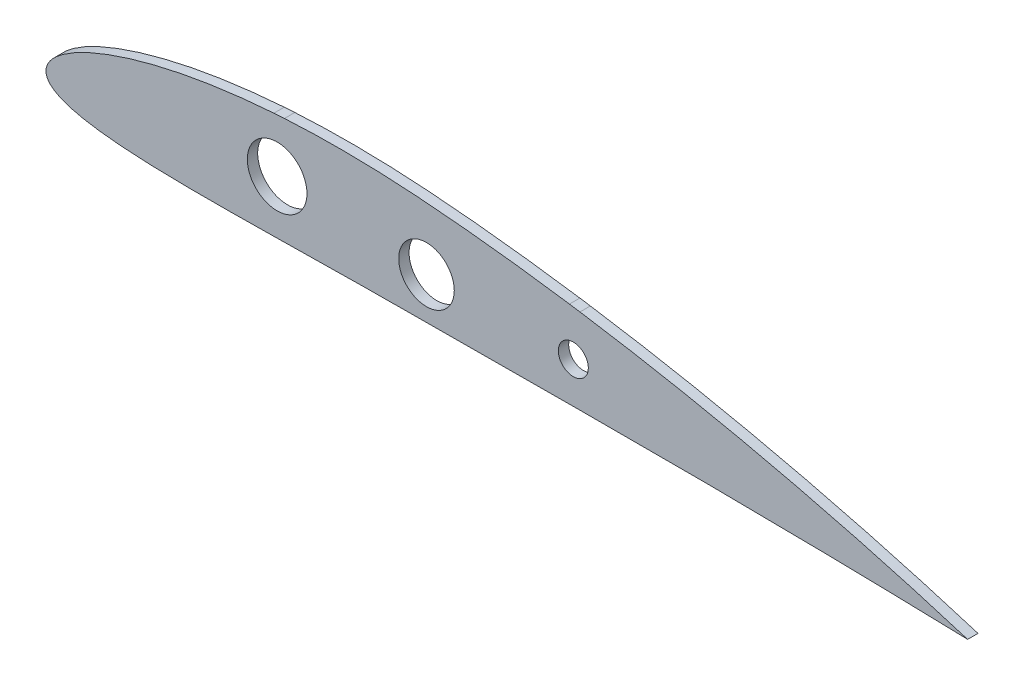
from build123d import *

# Parameters (mm, degrees)
SKETCH_1_R      = 4.05
SKETCH_1_R_2    = 7.5
SKETCH_1_R_3    = 8.05
EXTRUDE_1_DEPTH = 1.4


with BuildPart() as part:
    # Эскиз1 → Бобышка-Вытянуть1 (new, symmetric)
    with BuildSketch(Plane.XY):
        with BuildLine():
            Line((150.666396798, 129.82962039), (147.830444309, 130.255907631))
            add(Edge.make_bspline(
                [(147.830444309, 130.255907631), (141.461413304, 131.198524366), (128.693359955, 132.886388705), (112.67043132, 134.461645249), (99.826968741, 135.315000175), (86.964020356, 135.731264376), (77.308341909, 135.549477481), (70.887732655, 135.171040436)],
                knots=[0.429725304, 0.429725304, 0.429725304, 0.429725304, 0.50454493, 0.579364556, 0.61677437, 0.654184183, 0.729003809, 0.729003809, 0.729003809, 0.729003809], degree=3))
            Line((70.887732655, 135.171040436), (68.034324351, 134.985663537))
            add(Edge.make_bspline(
                [(68.034324351, 134.985663537), (62.466327292, 134.590052619), (54.128766773, 133.70015523), (43.125220573, 131.802909904), (34.953776148, 129.977054104), (26.907191476, 127.675989274), (20.367980904, 125.262128549), (15.336549935, 122.888373263), (11.739560791, 120.808049659), (8.991532459, 118.696410574), (7.481749343, 116.886227925), (6.915411804, 115.858161553), (6.707897041, 115.274334726), (6.625457542, 114.936901915), (6.585428501, 114.77290226)],
                knots=[0.740090669, 0.740090669, 0.740090669, 0.740090669, 0.805048089, 0.837526799, 0.870005509, 0.902484219, 0.934962929, 0.951202284, 0.967441639, 0.983680994, 0.991800672, 0.99586051, 0.99789043, 0.999920349, 0.999920349, 0.999920349, 0.999920349], degree=3))
            add(Edge.make_bspline(
                [(6.585428501, 114.77290226), (6.563664146, 114.614273348), (6.519009347, 114.285406452), (6.51479073, 113.71087901), (6.741898783, 112.661535219), (7.660184293, 111.409854013), (9.25908473, 110.308268876), (11.044608157, 109.487380203), (12.922194441, 108.850067694), (15.490126457, 108.172753601), (18.768502962, 107.558568007), (22.745443376, 107.043168294), (28.077313003, 106.557350362), (34.7695904, 106.213470375), (42.813490811, 106.037235573), (50.86267748, 106.006056339), (58.913615572, 106.062256394), (64.282042193, 106.132538161), (66.96601172, 106.171159397)],
                knots=[8.1168e-05, 8.1168e-05, 8.1168e-05, 8.1168e-05, 0.0020673, 0.004053433, 0.008025699, 0.015970231, 0.023914763, 0.031859294, 0.039803826, 0.047748358, 0.063637421, 0.079526485, 0.095415548, 0.127193675, 0.158971802, 0.190749929, 0.222528056, 0.254306183, 0.254306183, 0.254306183, 0.254306183], degree=3))
            Line((66.96601172, 106.171159397), (69.819069007, 106.21341025))
            add(Edge.make_bspline(
                [(69.819069007, 106.21341025), (76.253856733, 106.311006841), (85.904794849, 106.472137373), (98.777945674, 106.610759512), (111.6511009, 106.649514986), (127.735402572, 106.732475133), (140.606952957, 106.813706415), (147.042263767, 106.84262009)],
                knots=[0.265565078, 0.265565078, 0.265565078, 0.265565078, 0.341733085, 0.379817088, 0.417901091, 0.494069098, 0.570237104, 0.570237104, 0.570237104, 0.570237104], degree=3))
            Line((147.042263767, 106.84262009), (149.894619256, 106.85475599))
            add(Edge.make_bspline(
                [(149.894619256, 106.85475599), (158.680275083, 106.889957075), (176.251614136, 106.916321205), (202.609661936, 106.730645333), (228.96468106, 106.292568252), (246.530526637, 105.8505877), (255.312881654, 105.606761115)],
                knots=[0.581490104, 0.581490104, 0.581490104, 0.581490104, 0.685469054, 0.789448004, 0.893426954, 0.997405904, 0.997405904, 0.997405904, 0.997405904], degree=3))
            add(Edge.make_bspline(
                [(255.312881654, 105.606761115), (246.756257413, 108.260896884), (229.544442337, 113.256971155), (203.470240893, 119.79978809), (177.1785709, 125.404416996), (159.522198848, 128.478032218), (150.666396798, 129.82962039)],
                knots=[0.00222758, 0.00222758, 0.00222758, 0.00222758, 0.106325046, 0.210422513, 0.31451998, 0.418617446, 0.418617446, 0.418617446, 0.418617446], degree=3))
        make_face()
        with Locations((148.868108764, 117.844985284)):
            Circle(SKETCH_1_R, mode=Mode.SUBTRACT)
        with Locations((109.232573951, 117.844985284)):
            Circle(SKETCH_1_R_2, mode=Mode.SUBTRACT)
        with Locations((68.916842603, 120.636945021)):
            Circle(SKETCH_1_R_3, mode=Mode.SUBTRACT)
    extrude(amount=EXTRUDE_1_DEPTH, both=True)


solid = part.part
